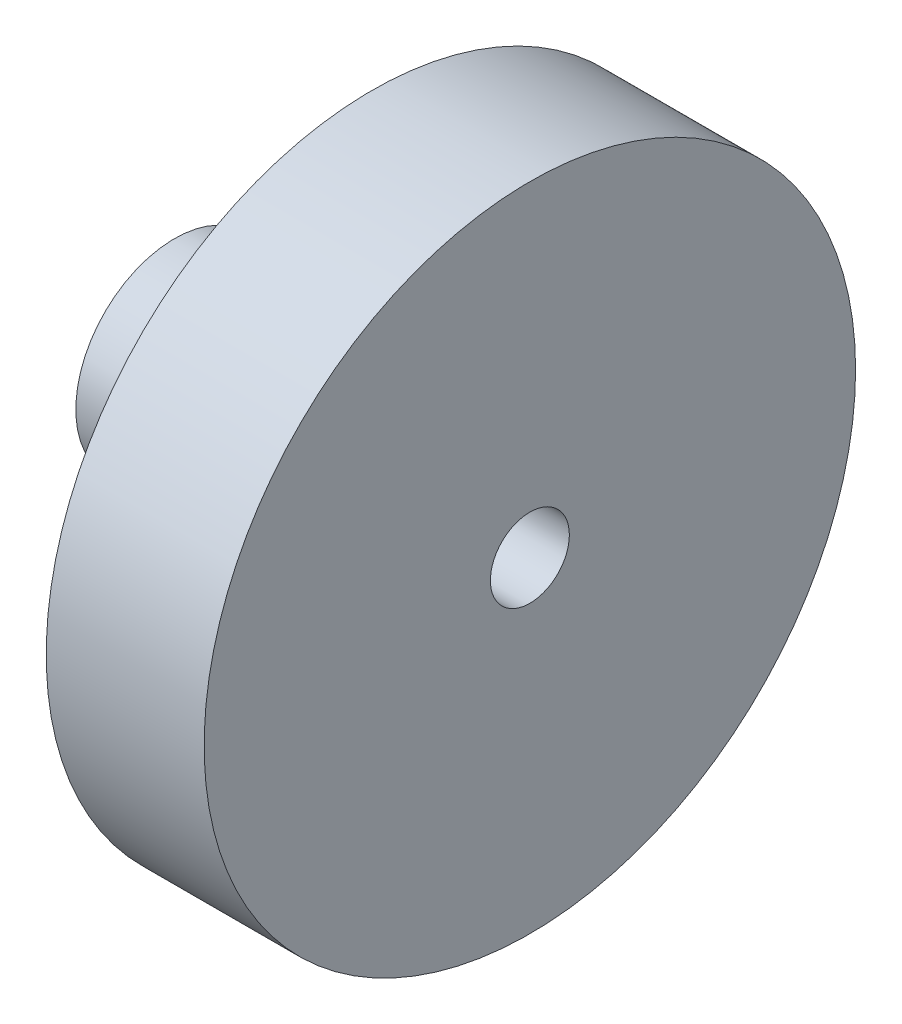
from build123d import *

# Parameters (mm, degrees)
BROCA_DE_ROSQUEAR_PARA_TARRAXA_DE_M2_2X0_REACH = 32.257
BROCA_DE_ROSQUEAR_PARA_TARRAXA_DE_M2_2_R       = 0.875


with BuildPart() as part:
    # Esboço3 → Revolução1 (revolve)
    with BuildSketch(Plane.XY, mode=Mode.PRIVATE) as revolu_o1_sk:
        Polygon((0, 16.5), (0, 2), (-18, 2), (-18, 5), (-8, 5), (-8, 16.5), align=None)
    revolve(revolu_o1_sk.sketch.rotate(Axis((0, 0, 0), (-1, 0, 0)), 90), axis=Axis((0, 0, 0), (-1, 0, 0)))

    # Broca de rosquear para tarraxa de M2 2 (on position points) → Broca de rosquear para tarraxa de M2.2x0.451 (cut, up to next)
    with BuildSketch(Plane(origin=(-13.453220178, 5, 0), x_dir=(0, 0, 1), z_dir=(0, 1, 0)), mode=Mode.PRIVATE) as broca_de_rosquear_para_tarraxa_de_m2_2x0_sk1:
        Circle(BROCA_DE_ROSQUEAR_PARA_TARRAXA_DE_M2_2_R)
    broca_de_rosquear_para_tarraxa_de_m2_2x0_tool1 = extrude(broca_de_rosquear_para_tarraxa_de_m2_2x0_sk1.sketch, amount=-BROCA_DE_ROSQUEAR_PARA_TARRAXA_DE_M2_2X0_REACH, mode=Mode.PRIVATE) & part.part
    add(broca_de_rosquear_para_tarraxa_de_m2_2x0_tool1.solids().sort_by_distance((-13.45322, 5, 0))[0], mode=Mode.SUBTRACT)


solid = part.part
